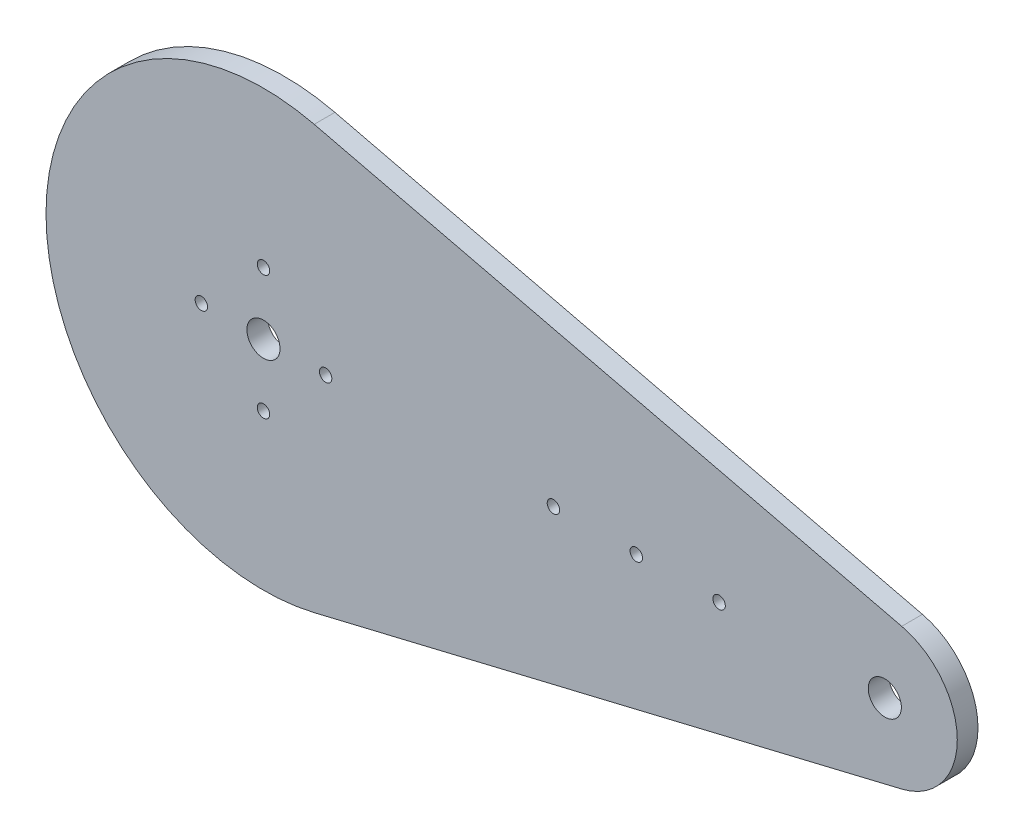
from build123d import *

# Parameters (mm, degrees)
SKETCH1_R           = 1.5
SKETCH1_R_2         = 4
BOSS_EXTRUDE1_DEPTH = 5


with BuildPart() as part:
    # Sketch1 → Boss-Extrude1 (new body)
    with BuildSketch(Plane.XY):
        with BuildLine():
            ThreePointArc((12.25, 51.05083251), (-52.5, 0), (12.25, -51.05083251))
            Line((12.25, -51.05083251), (154.083333333, -17.01694417))
            ThreePointArc((154.083333333, -17.01694417), (167.5, 0), (154.083333333, 17.01694417))
            Line((154.083333333, 17.01694417), (12.25, 51.05083251))
        make_face()
        with Locations((0, -15)):
            Circle(SKETCH1_R, mode=Mode.SUBTRACT)
        with Locations((-15, 0)):
            Circle(SKETCH1_R, mode=Mode.SUBTRACT)
        Circle(SKETCH1_R_2, mode=Mode.SUBTRACT)
        with BuildLine():
            ThreePointArc((16.5, 0), (15, -1.5), (13.5, 0))
            ThreePointArc((13.5, 0), (15, 1.5), (16.5, 0))
        make_face(mode=Mode.SUBTRACT)
        with Locations((0, 15)):
            Circle(SKETCH1_R, mode=Mode.SUBTRACT)
        with Locations((70, 0)):
            Circle(SKETCH1_R, mode=Mode.SUBTRACT)
        with Locations((90, 0)):
            Circle(SKETCH1_R, mode=Mode.SUBTRACT)
        with Locations((110, 0)):
            Circle(SKETCH1_R, mode=Mode.SUBTRACT)
        with Locations((150, 0)):
            Circle(SKETCH1_R_2, mode=Mode.SUBTRACT)
    extrude(amount=BOSS_EXTRUDE1_DEPTH)


solid = part.part
